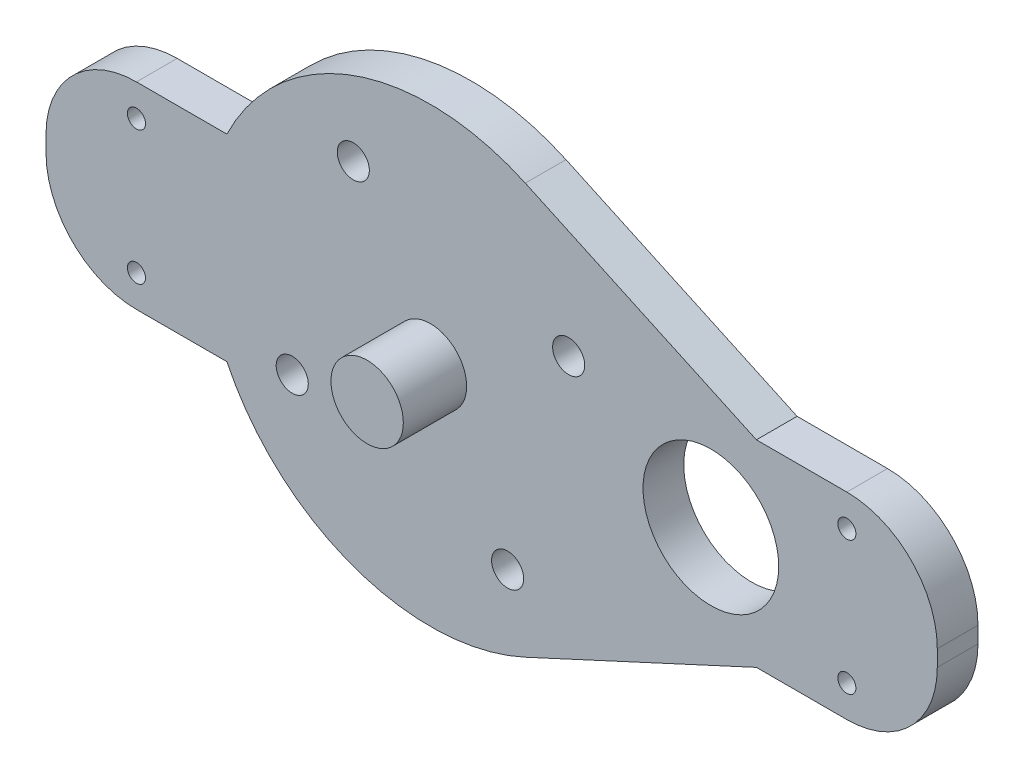
from build123d import *

# Parameters (mm, degrees)
BOSS_EXTRUDE1_DEPTH = 4.5
SKETCH2_R           = 7.5
CUT_EXTRUDE1_DEPTH  = 50.942466899
SKETCH3_R           = 4
BOSS_EXTRUDE2_DEPTH = 7
BOSS_EXTRUDE3_DEPTH = 4.5
FILLET1_R           = 10
SKETCH6_R           = 1
CUT_EXTRUDE2_DEPTH  = 63.42486639
CUT_EXTRUDE3_DEPTH  = 3
SKETCH10_R          = 1
CUT_EXTRUDE4_DEPTH  = 62.754464971
SKETCH11_R          = 1.775
CUT_EXTRUDE5_DEPTH  = 2.5


with BuildPart() as part:
    # Sketch1 → Boss-Extrude1 (new body)
    with BuildSketch(Plane.XY):
        with BuildLine():
            Line((10.483870968, 22.695560128), (36.032258065, 10.893868862))
            ThreePointArc((36.032258065, 10.893868862), (43, 0), (36.032258065, -10.893868862))
            Line((36.032258065, -10.893868862), (10.483870968, -22.695560128))
            ThreePointArc((10.483870968, -22.695560128), (-25, 0), (10.483870968, 22.695560128))
        make_face()
    extrude(amount=BOSS_EXTRUDE1_DEPTH)

    # Sketch2 → Cut-Extrude1 (cut, through all)
    with BuildSketch(Plane.XY.offset(4.5)):
        with Locations((31, 0)):
            Circle(SKETCH2_R)
    extrude(amount=-CUT_EXTRUDE1_DEPTH, mode=Mode.SUBTRACT)

    # Sketch3 → Boss-Extrude2 (add)
    with BuildSketch(Plane.XY.offset(4.5)):
        Circle(SKETCH3_R)
    extrude(amount=BOSS_EXTRUDE2_DEPTH)

    # Sketch4 → Boss-Extrude3 (add)
    with BuildSketch(Plane(origin=(0, 0, 0), x_dir=(-1, 0, 0), z_dir=(0, 0, -1))):
        with BuildLine():
            Line((-36.032258065, 10.893868862), (-56.032258065, 10.893868862))
            Line((-56.032258065, 10.893868862), (-56.032258065, -10.893868862))
            Line((-56.032258065, -10.893868862), (-36.032258065, -10.893868862))
            ThreePointArc((-36.032258065, -10.893868862), (-43, 0), (-36.032258065, 10.893868862))
        make_face()
        with BuildLine():
            Line((22.501635968, 10.893868862), (42.501635968, 10.893868862))
            Line((42.501635968, 10.893868862), (42.501635968, -10.893868862))
            Line((42.501635968, -10.893868862), (22.501635968, -10.893868862))
            ThreePointArc((22.501635968, -10.893868862), (25, 0), (22.501635968, 10.893868862))
        make_face()
    extrude(amount=-BOSS_EXTRUDE3_DEPTH)

    # Fillet1
    fillet1_edges = [part.edges().sort_by_distance(p)[0] for p in [
        (56.032258065, 10.893868862, 2.25),
        (56.032258065, -10.893868862, 2.25),
        (-42.501635968, -10.893868862, 2.25),
        (-42.501635968, 10.893868862, 2.25),
    ]]
    fillet(fillet1_edges, radius=FILLET1_R)

    # Sketch6 → Cut-Extrude2 (cut, through all)
    with BuildSketch(Plane(origin=(0, 0, 0), x_dir=(-1, 0, 0), z_dir=(0, 0, -1))):
        with Locations((32.501635968, -7.384406603)):
            Circle(SKETCH6_R)
        with Locations((32.501635968, 7.384406603)):
            Circle(SKETCH6_R)
        with Locations((-46.032258065, -7.384406603)):
            Circle(SKETCH6_R)
        with Locations((-46.032258065, 7.384406603)):
            Circle(SKETCH6_R)
    extrude(amount=-CUT_EXTRUDE2_DEPTH, mode=Mode.SUBTRACT)

    # Sketch7 → Cut-Extrude3 (cut)
    with BuildSketch(Plane(origin=(0, 0, 0), x_dir=(-1, 0, 0), z_dir=(0, 0, -1))):
        Polygon((-46.040823363, 9.636056412), (-47.986526649, 8.502813742), (-47.97796135, 6.251163933), (-46.023692766, 5.132756795), (-44.07798948, 6.265999465), (-44.086554779, 8.517649274), align=None)
        Polygon((-46.040823363, -5.132756795), (-47.986526649, -6.265999465), (-47.97796135, -8.517649274), (-46.023692766, -9.636056412), (-44.07798948, -8.502813742), (-44.086554779, -6.251163933), align=None)
        Polygon((32.500854226, 9.636072568), (30.551245171, 8.509562577), (30.552026913, 6.257896613), (32.502417709, 5.132740639), (34.452026765, 6.259250629), (34.451245023, 8.510916594), align=None)
        Polygon((32.500854226, -5.132740639), (30.551245171, -6.259250629), (30.552026913, -8.510916594), (32.502417709, -9.636072568), (34.452026765, -8.509562577), (34.451245023, -6.257896613), align=None)
    extrude(amount=-CUT_EXTRUDE3_DEPTH, mode=Mode.SUBTRACT)

    # Sketch10 → Cut-Extrude4 (cut, through all)
    with BuildSketch(Plane.XY.offset(4.5)):
        with Locations((8.530630169, -15.279998329)):
            Circle(SKETCH10_R)
        with Locations((-15.279998329, -8.530630169)):
            Circle(SKETCH10_R)
        with Locations((-8.530630169, 15.279998329)):
            Circle(SKETCH10_R)
        with Locations((15.279998329, 8.530630169)):
            Circle(SKETCH10_R)
    extrude(amount=-CUT_EXTRUDE4_DEPTH, mode=Mode.SUBTRACT)

    # Sketch11 → Cut-Extrude5 (cut)
    with BuildSketch(Plane.XY.offset(4.5)):
        with Locations((-8.530630169, 15.279998329)):
            Circle(SKETCH11_R)
        with Locations((15.279998329, 8.530630169)):
            Circle(SKETCH11_R)
        with Locations((8.530630169, -15.279998329)):
            Circle(SKETCH11_R)
        with Locations((-15.279998329, -8.530630169)):
            Circle(SKETCH11_R)
    extrude(amount=-CUT_EXTRUDE5_DEPTH, mode=Mode.SUBTRACT)


solid = part.part
